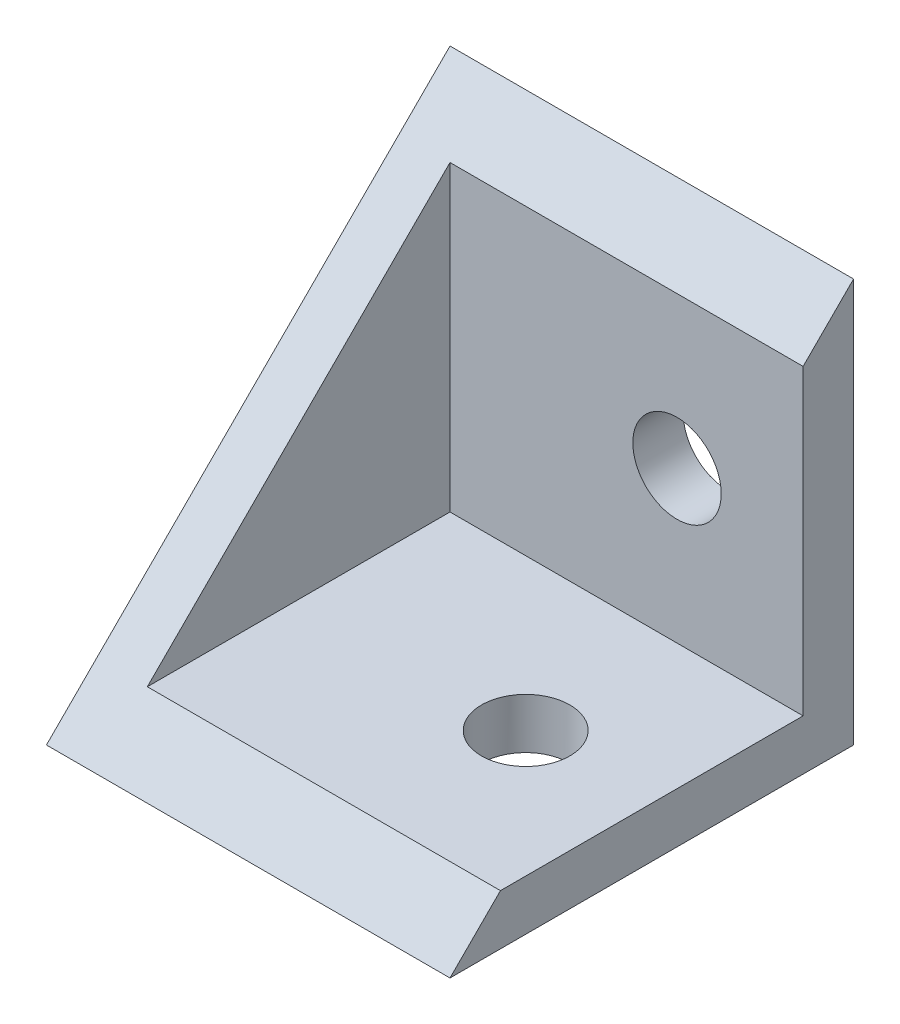
from build123d import *

# Parameters (mm, degrees)
SKETCH1_W               = 25.4
SKETCH1_H               = 25.4
BOSS_EXTRUDE1_DEPTH     = 25.4
CUT_EXTRUDE1_DEPTH      = 25.4
CUT_EXTRUDE2_DEPTH      = 39.1
CUT_EXTRUDE2_DEPTH_BACK = 22.225
SKETCH4_R               = 2.7813
CUT_EXTRUDE3_DEPTH      = 22.225
SKETCH5_R               = 2.7813
CUT_EXTRUDE4_DEPTH      = 22.225


with BuildPart() as part:
    # Sketch1 → Boss-Extrude1 (new body)
    with BuildSketch(Plane(origin=(0, 0, 0), x_dir=(1, 0, 0), z_dir=(0, 1, 0))):
        Rectangle(SKETCH1_W, SKETCH1_H)
    extrude(amount=BOSS_EXTRUDE1_DEPTH)

    # Sketch2 → Cut-Extrude1 (cut)
    with BuildSketch(Plane(origin=(12.7, 0, 0), x_dir=(0, 0, -1), z_dir=(1, 0, 0))):
        Polygon((-12.7, 25.4), (12.7, 25.4), (-12.7, 0), align=None)
    extrude(amount=-CUT_EXTRUDE1_DEPTH, mode=Mode.SUBTRACT)

    # Sketch3 → Cut-Extrude2 (cut, two sides: drawn at the far end of the back side and taken through both)
    with BuildSketch(Plane(origin=(12.7, 0, 0), x_dir=(0, 0, -1), z_dir=(1, 0, 0)).offset(-CUT_EXTRUDE2_DEPTH_BACK)):
        Polygon((-82.386792847, 3.175), (-9.525, 3.175), (9.525, 3.175), (9.525, 22.225), (9.525, 95.086792847), (-93.517135624, 198.128928471), (-185.428928471, 106.217135624), align=None)
    extrude(amount=CUT_EXTRUDE2_DEPTH + CUT_EXTRUDE2_DEPTH_BACK, mode=Mode.SUBTRACT)

    # Sketch4 → Cut-Extrude3 (cut)
    with BuildSketch(Plane.XY.offset(-9.525)):
        with Locations((4.7625, 12.7)):
            Circle(SKETCH4_R)
    extrude(amount=-CUT_EXTRUDE3_DEPTH, mode=Mode.SUBTRACT)

    # Sketch5 → Cut-Extrude4 (cut)
    with BuildSketch(Plane(origin=(0, 3.175, 0), x_dir=(1, 0, 0), z_dir=(0, 1, 0))):
        with Locations(Location((4.7625, 0, 0), (0, 0, 270))):
            Circle(SKETCH5_R)
    extrude(amount=-CUT_EXTRUDE4_DEPTH, mode=Mode.SUBTRACT)


solid = part.part
